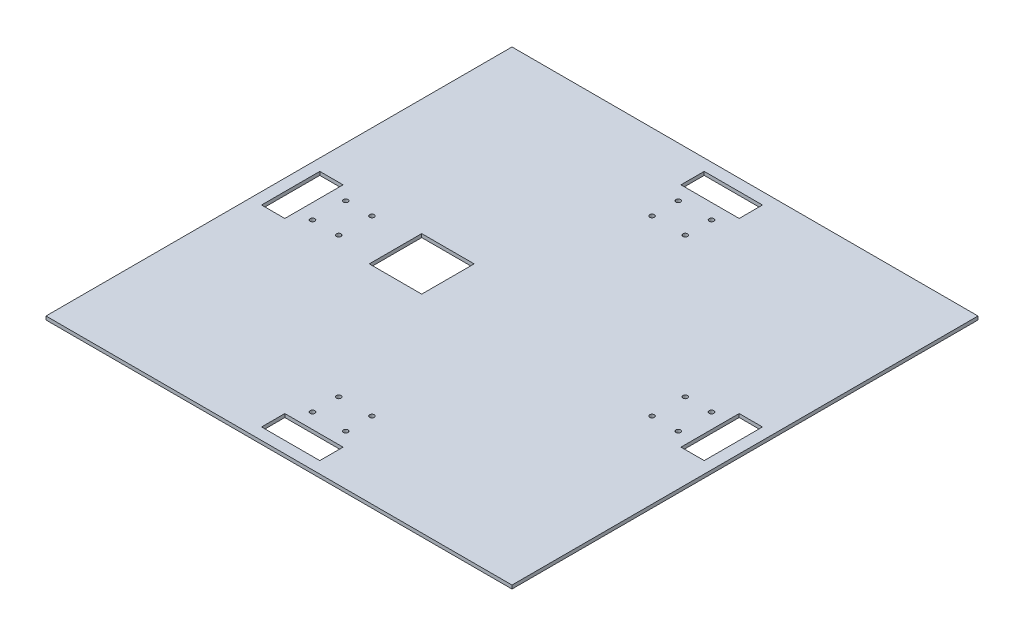
from build123d import *

# Parameters (mm, degrees)
SKETCH1_W      = 400
SKETCH1_H      = 400
SKETCH1_R      = 2
SKETCH1_W_2    = 20
SKETCH1_H_2    = 50
SKETCH1_W_3    = 50
SKETCH1_H_3    = 20
SKETCH1_W_4    = 45
SKETCH1_H_4    = 45
EXTRUDE1_DEPTH = 3


with BuildPart() as part:
    # Sketch1 → Extrude1 (new body)
    with BuildSketch(Plane(origin=(0, 0, 0), x_dir=(1, 0, 0), z_dir=(0, 1, 0))):
        with Locations((200, 200)):
            Rectangle(SKETCH1_W, SKETCH1_H)
        with Locations(Location((185.75, 43, 0), (0, 0, 270))):
            Circle(SKETCH1_R, mode=Mode.SUBTRACT)
        with Locations(Location((185.75, 65.5, 0), (0, 0, 270))):
            Circle(SKETCH1_R, mode=Mode.SUBTRACT)
        with Locations(Location((214.25, 65.5, 0), (0, 0, 90))):
            Circle(SKETCH1_R, mode=Mode.SUBTRACT)
        with Locations(Location((214.25, 43, 0), (0, 0, 90))):
            Circle(SKETCH1_R, mode=Mode.SUBTRACT)
        with Locations(Location((43, 214.25, 0), (0, 0, 270))):
            Circle(SKETCH1_R, mode=Mode.SUBTRACT)
        with Locations(Location((65.5, 214.25, 0), (0, 0, 270))):
            Circle(SKETCH1_R, mode=Mode.SUBTRACT)
        with Locations(Location((65.5, 185.75, 0), (0, 0, 90))):
            Circle(SKETCH1_R, mode=Mode.SUBTRACT)
        with Locations(Location((43, 185.75, 0), (0, 0, 90))):
            Circle(SKETCH1_R, mode=Mode.SUBTRACT)
        with Locations(Location((214.25, 357, 0), (0, 0, 270))):
            Circle(SKETCH1_R, mode=Mode.SUBTRACT)
        with Locations(Location((214.25, 334.5, 0), (0, 0, 270))):
            Circle(SKETCH1_R, mode=Mode.SUBTRACT)
        with Locations(Location((185.75, 334.5, 0), (0, 0, 90))):
            Circle(SKETCH1_R, mode=Mode.SUBTRACT)
        with Locations(Location((185.75, 357, 0), (0, 0, 90))):
            Circle(SKETCH1_R, mode=Mode.SUBTRACT)
        with Locations(Location((357, 185.75, 0), (0, 0, 270))):
            Circle(SKETCH1_R, mode=Mode.SUBTRACT)
        with Locations(Location((334.5, 185.75, 0), (0, 0, 270))):
            Circle(SKETCH1_R, mode=Mode.SUBTRACT)
        with Locations(Location((334.5, 214.25, 0), (0, 0, 90))):
            Circle(SKETCH1_R, mode=Mode.SUBTRACT)
        with Locations(Location((357, 214.25, 0), (0, 0, 90))):
            Circle(SKETCH1_R, mode=Mode.SUBTRACT)
        with Locations((20, 200)):
            Rectangle(SKETCH1_W_2, SKETCH1_H_2, mode=Mode.SUBTRACT)
        with Locations((200, 20)):
            Rectangle(SKETCH1_W_3, SKETCH1_H_3, mode=Mode.SUBTRACT)
        with Locations((200, 380)):
            Rectangle(SKETCH1_W_3, SKETCH1_H_3, mode=Mode.SUBTRACT)
        with Locations((380, 200)):
            Rectangle(SKETCH1_W_2, SKETCH1_H_2, mode=Mode.SUBTRACT)
        with Locations((122.5, 200)):
            Rectangle(SKETCH1_W_4, SKETCH1_H_4, mode=Mode.SUBTRACT)
    extrude(amount=EXTRUDE1_DEPTH)


solid = part.part
